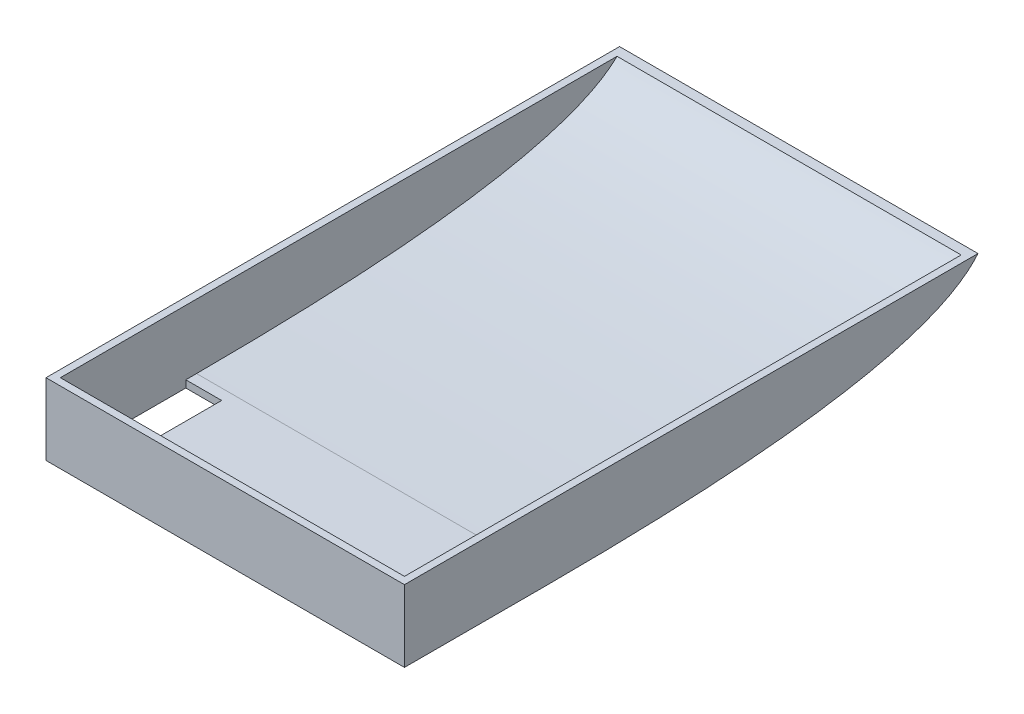
from build123d import *

# Parameters (mm, degrees)
BOSS_EXTRUDE1_DEPTH = 63.5
SHELL1_T            = -2.54
SKETCH4_W           = 12.7
SKETCH4_H           = 44.45
CUT_EXTRUDE1_DEPTH  = 168.042419907


with BuildPart() as part:
    # Sketch1 → Boss-Extrude1 (new, symmetric)
    with BuildSketch(Plane(origin=(0, 0, 0), x_dir=(0, 0, -1), z_dir=(1, 0, 0))):
        with BuildLine():
            Line((-50.8, 25.4), (-50.8, 0))
            Line((-50.8, 0), (0, 0))
            add(Edge.make_bspline(
                [(0, 0), (90.399909762, 0.128526821), (138.872298675, 8.862290589), (152.4, 25.4)],
                knots=[0, 0, 0, 0, 1, 1, 1, 1], degree=3))
            Line((152.4, 25.4), (-50.8, 25.4))
        make_face()
    extrude(amount=BOSS_EXTRUDE1_DEPTH, both=True)

    # Shell1
    shell1_openings = [part.faces().sort_by_distance(p)[0] for p in [
        (0, 25.4, -50.8),
    ]]
    offset(amount=SHELL1_T, openings=shell1_openings, kind=Kind.INTERSECTION)

    # Sketch4 → Cut-Extrude1 (cut, through all)
    with BuildSketch(Plane(origin=(0, 25.4, 0), x_dir=(1, 0, 0), z_dir=(0, 1, 0))):
        with Locations((-54.61, -26.035)):
            Rectangle(SKETCH4_W, SKETCH4_H)
        with Locations((54.61, -26.035)):
            Rectangle(SKETCH4_W, SKETCH4_H)
    extrude(amount=-CUT_EXTRUDE1_DEPTH, mode=Mode.SUBTRACT)


solid = part.part
